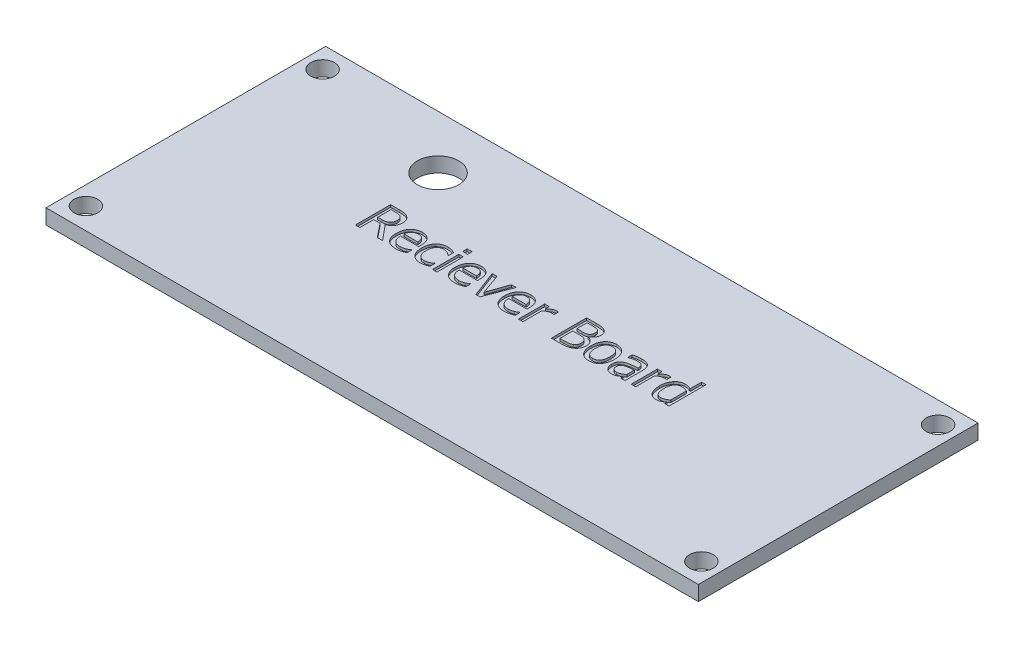
from build123d import *

# Parameters (mm, degrees)
SKETCH1_W           = 70
SKETCH1_H           = 30
SKETCH1_R           = 1.27
BOSS_EXTRUDE1_DEPTH = 1.6
SKETCH2_W           = 0.478039706
SKETCH2_H           = 2.820434261
SKETCH2_W_2         = 0.525843676
SKETCH2_H_2         = 0.478039705
CUT_EXTRUDE1_DEPTH  = 0.254
SKETCH3_R           = 2.2225
CUT_EXTRUDE2_DEPTH  = 39.112465284


with BuildPart() as part:
    # Sketch1 → Boss-Extrude1 (new body)
    with BuildSketch(Plane(origin=(0, 0, 0), x_dir=(1, 0, 0), z_dir=(0, 1, 0))):
        Rectangle(SKETCH1_W, SKETCH1_H)
        with Locations(Location((-33.02, 12.7, 0), (0, 0, 270))):
            Circle(SKETCH1_R, mode=Mode.SUBTRACT)
        with Locations(Location((-33.02, -12.7, 0), (0, 0, 270))):
            Circle(SKETCH1_R, mode=Mode.SUBTRACT)
        with Locations(Location((33.02, 12.7, 0), (0, 0, 270))):
            Circle(SKETCH1_R, mode=Mode.SUBTRACT)
        with Locations(Location((33.02, -12.7, 0), (0, 0, 270))):
            Circle(SKETCH1_R, mode=Mode.SUBTRACT)
    extrude(amount=BOSS_EXTRUDE1_DEPTH)

    # Sketch2 → Cut-Extrude1 (cut)
    # profile 1 of 14: a face of its own
    with BuildSketch(Plane(origin=(0, 1.6, 0), x_dir=(1, 0, 0), z_dir=(0, 1, 0))):
        with BuildLine():
            Line((-13.887053439, 0), (-14.450243967, 0))
            Line((-14.450243967, 0), (-15.640861608, 1.481923086))
            Line((-15.640861608, 1.481923086), (-16.325055936, 1.481923086))
            Line((-16.325055936, 1.481923086), (-16.325055936, 0))
            Line((-16.325055936, 0), (-16.803095641, 0))
            Line((-16.803095641, 0), (-16.803095641, 3.776513672))
            Line((-16.803095641, 3.776513672), (-15.838052986, 3.776513672))
            add(Edge.make_bspline(
                [(-15.838052986, 3.776513672), (-15.786506721, 3.776121723), (-15.687848091, 3.775371539), (-15.546320768, 3.768693237), (-15.417970741, 3.757661959), (-15.300472771, 3.742556709), (-15.190459468, 3.718933758), (-15.085591724, 3.682290452), (-14.982604574, 3.635527111), (-14.918380546, 3.594808339), (-14.885708261, 3.574093734)],
                knots=[0, 0, 0, 0, 1.250021561, 2.392518902, 3.435016966, 4.373492712, 5.264191783, 6.15783316, 7.062846051, 8, 8, 8, 8], degree=3))
            add(Edge.make_bspline(
                [(-14.885708261, 3.574093734), (-14.853997125, 3.551939597), (-14.791207784, 3.508073504), (-14.707715848, 3.429296036), (-14.635006774, 3.341329418), (-14.571949601, 3.244099511), (-14.521544073, 3.13573354), (-14.485554783, 3.015325393), (-14.46500475, 2.882885163), (-14.462171449, 2.790629582), (-14.460701085, 2.742752809)],
                knots=[0, 0, 0, 0, 0.949219863, 1.879494016, 2.808983798, 3.7471254, 4.718469304, 5.734235897, 6.824163568, 8, 8, 8, 8], degree=3))
            add(Edge.make_bspline(
                [(-14.460701085, 2.742752809), (-14.461192274, 2.708370793), (-14.462151829, 2.641204232), (-14.472085548, 2.542570573), (-14.488705457, 2.448314187), (-14.510520908, 2.35791213), (-14.54026143, 2.272228083), (-14.575050057, 2.19049346), (-14.617056234, 2.113204363), (-14.665849295, 2.040857408), (-14.719762676, 1.972890302), (-14.778150736, 1.908939039), (-14.841845455, 1.850042056), (-14.909962746, 1.795341833), (-14.982656711, 1.745260311), (-15.059606035, 1.699519572), (-15.141697279, 1.659001569), (-15.198773666, 1.63569563), (-15.227805425, 1.623841124)],
                knots=[0, 0, 0, 0, 1.135849185, 2.218924117, 3.271251503, 4.296900366, 5.288183372, 6.264778873, 7.229344086, 8.190006651, 9.144696713, 10.093840338, 11.04856585, 12.008382513, 12.978301311, 13.963179042, 14.963976192, 16, 16, 16, 16], degree=3))
            Line((-15.227805425, 1.623841124), (-13.887053439, 0))
        make_face()
        with BuildLine():
            add(Edge.make_bspline(
                [(-14.986544761, 2.710634516), (-14.987322612, 2.737550273), (-14.988841193, 2.790097343), (-14.998892205, 2.866664154), (-15.018040647, 2.938129), (-15.043397444, 3.005158417), (-15.075794881, 3.067605662), (-15.117955218, 3.123466649), (-15.167249773, 3.174343318), (-15.205926774, 3.202178083), (-15.225564614, 3.216310892)],
                knots=[0, 0, 0, 0, 1.106361022, 2.159925501, 3.165170322, 4.140113613, 5.101428227, 6.044931032, 7.007334338, 8, 8, 8, 8], degree=3))
            add(Edge.make_bspline(
                [(-15.225564614, 3.216310892), (-15.243763939, 3.227671825), (-15.280595723, 3.250664073), (-15.341108414, 3.278179507), (-15.405950741, 3.300442334), (-15.476032459, 3.317524252), (-15.552065248, 3.331290448), (-15.636246719, 3.339427992), (-15.728897447, 3.345992599), (-15.793720344, 3.346180003), (-15.827595868, 3.346277937)],
                knots=[0, 0, 0, 0, 0.823266866, 1.666126959, 2.546139776, 3.452968417, 4.434002246, 5.511135704, 6.699354941, 8, 8, 8, 8], degree=3))
            Line((-15.827595868, 3.346277937), (-16.325055936, 3.346277937))
            Line((-16.325055936, 3.346277937), (-16.325055936, 1.912158821))
            Line((-16.325055936, 1.912158821), (-15.882869209, 1.912158821))
            add(Edge.make_bspline(
                [(-15.882869209, 1.912158821), (-15.847748388, 1.912502483), (-15.779165095, 1.91317358), (-15.679199425, 1.920895333), (-15.584707508, 1.932841136), (-15.495552492, 1.948622546), (-15.411233816, 1.971665641), (-15.334420901, 2.007656644), (-15.262219712, 2.051503588), (-15.22100378, 2.089430743), (-15.200168754, 2.108603263)],
                knots=[0, 0, 0, 0, 1.15528095, 2.256011433, 3.296444933, 4.287767307, 5.234068766, 6.161497088, 7.070620185, 8, 8, 8, 8], degree=3))
            add(Edge.make_bspline(
                [(-15.200168754, 2.108603263), (-15.182450094, 2.126823432), (-15.147026428, 2.163249732), (-15.103750863, 2.225805217), (-15.066020672, 2.292215373), (-15.037530736, 2.364660734), (-15.013825676, 2.442213633), (-14.997867572, 2.52609797), (-14.987921848, 2.616277417), (-14.98701392, 2.678488063), (-14.986544761, 2.710634516)],
                knots=[0, 0, 0, 0, 0.926938848, 1.853163429, 2.769284665, 3.711756545, 4.690105091, 5.728268696, 6.826115637, 8, 8, 8, 8], degree=3))
        make_face(mode=Mode.SUBTRACT)
    # profile 2 of 14: a face of its own
    with BuildSketch(Plane(origin=(0, 1.6, 0), x_dir=(1, 0, 0), z_dir=(0, 1, 0))):
        with BuildLine():
            add(Edge.make_bspline(
                [(-12.416334408, -0.047803971), (-12.471168186, -0.046755421), (-12.577906876, -0.04471433), (-12.733206157, -0.026027222), (-12.879537078, 0.002096439), (-13.015925966, 0.04445528), (-13.143547109, 0.097262978), (-13.261016838, 0.163453389), (-13.369566982, 0.240681418), (-13.467791592, 0.330005432), (-13.555219378, 0.430454672), (-13.63213608, 0.540881747), (-13.696412929, 0.661880071), (-13.748579531, 0.792763555), (-13.789919711, 0.933241083), (-13.818564666, 1.08383659), (-13.835888965, 1.244488789), (-13.838107769, 1.354898813), (-13.839249468, 1.411711005)],
                knots=[0, 0, 0, 0, 1.134380914, 2.208170522, 3.232879553, 4.214092303, 5.158657297, 6.086073904, 6.998364966, 7.910321261, 8.826967652, 9.748928482, 10.689479218, 11.655913905, 12.660314108, 13.715357398, 14.82442239, 16, 16, 16, 16], degree=3))
            add(Edge.make_bspline(
                [(-13.839249468, 1.411711005), (-13.838017924, 1.467768182), (-13.835615056, 1.577141444), (-13.819367062, 1.736829692), (-13.79102053, 1.887483425), (-13.751401892, 2.029495086), (-13.700714722, 2.162932029), (-13.638525131, 2.287624672), (-13.564996317, 2.403328809), (-13.480560389, 2.509440443), (-13.386801667, 2.604696913), (-13.285509737, 2.68823589), (-13.177161104, 2.759113529), (-13.061876105, 2.816804248), (-12.939187793, 2.861101362), (-12.810097638, 2.893219966), (-12.673580659, 2.912009867), (-12.580469595, 2.91467789), (-12.532856586, 2.916042202)],
                knots=[0, 0, 0, 0, 1.199395152, 2.340142072, 3.429892914, 4.475587674, 5.490682445, 6.479391523, 7.451820572, 8.418585917, 9.375422142, 10.306492715, 11.222598817, 12.13983495, 13.058307876, 14.007969104, 14.981360766, 16, 16, 16, 16], degree=3))
            add(Edge.make_bspline(
                [(-12.532856586, 2.916042202), (-12.490239722, 2.915295533), (-12.407491955, 2.913845749), (-12.286986322, 2.899345008), (-12.174258451, 2.875602907), (-12.068292118, 2.842974498), (-11.969926407, 2.798934869), (-11.876910145, 2.746126801), (-11.791470564, 2.68050451), (-11.740103351, 2.630016225), (-11.714213591, 2.604569457)],
                knots=[0, 0, 0, 0, 1.1333801, 2.200646914, 3.223065537, 4.195129444, 5.144102495, 6.084833041, 7.034730342, 8, 8, 8, 8], degree=3))
            add(Edge.make_bspline(
                [(-11.714213591, 2.604569457), (-11.689527191, 2.577044919), (-11.639720288, 2.521511831), (-11.578680795, 2.425943808), (-11.524062621, 2.323121883), (-11.479204131, 2.210207722), (-11.44391419, 2.086133382), (-11.418932376, 1.94985217), (-11.40413594, 1.800444983), (-11.402235941, 1.696578257), (-11.401246971, 1.64251455)],
                knots=[0, 0, 0, 0, 0.854390883, 1.72380602, 2.615618053, 3.54654076, 4.529594302, 5.596469888, 6.748937673, 8, 8, 8, 8], degree=3))
            Line((-11.401246971, 1.64251455), (-11.401246971, 1.386315145))
            Line((-11.401246971, 1.386315145), (-13.361209763, 1.386315145))
            add(Edge.make_bspline(
                [(-13.361209763, 1.386315145), (-13.360606988, 1.346694102), (-13.359436383, 1.2697489), (-13.347139172, 1.158133668), (-13.327850054, 1.053718378), (-13.301385532, 0.956195768), (-13.26607069, 0.866176539), (-13.223353491, 0.783089023), (-13.172436638, 0.707391399), (-13.113814549, 0.639191627), (-13.048691854, 0.57820205), (-12.976675907, 0.525988363), (-12.898948031, 0.48165662), (-12.815845734, 0.444598503), (-12.725899313, 0.417236405), (-12.630384571, 0.397466795), (-12.529002274, 0.384005394), (-12.459453041, 0.38296503), (-12.423803779, 0.382431764)],
                knots=[0, 0, 0, 0, 1.216707001, 2.362879872, 3.444454967, 4.476175845, 5.461878662, 6.409455199, 7.340716607, 8.257416267, 9.166586768, 10.075306755, 10.983189478, 11.911210175, 12.864357389, 13.864904012, 14.905601209, 16, 16, 16, 16], degree=3))
            add(Edge.make_bspline(
                [(-12.423803779, 0.382431764), (-12.371909669, 0.384240778), (-12.26850302, 0.387845505), (-12.117058969, 0.414009433), (-11.974599688, 0.453340721), (-11.88548284, 0.489201902), (-11.842686762, 0.506423313)],
                knots=[0, 0, 0, 0, 1.040774474, 2.073896268, 3.075038149, 4, 4, 4, 4], degree=3))
            add(Edge.make_bspline(
                [(-11.842686762, 0.506423313), (-11.802599004, 0.524579945), (-11.728400468, 0.558186102), (-11.628417024, 0.612517761), (-11.546484799, 0.664868682), (-11.498668085, 0.70062365), (-11.476687612, 0.717059558)],
                knots=[0, 0, 0, 0, 1.24700779, 2.308089957, 3.222259739, 4, 4, 4, 4], degree=3))
            Line((-11.476687612, 0.717059558), (-11.449050942, 0.717059558))
            Line((-11.449050942, 0.717059558), (-11.449050942, 0.189722008))
            add(Edge.make_bspline(
                [(-11.449050942, 0.189722008), (-11.463745163, 0.184006812), (-11.494899947, 0.171889415), (-11.544186488, 0.152440751), (-11.598725081, 0.130804227), (-11.675498349, 0.099905635), (-11.768741393, 0.063578627), (-11.844030652, 0.04113445), (-11.879286677, 0.030624419)],
                knots=[0, 0, 0, 0, 0.618404991, 1.311146348, 2.078231156, 2.919664622, 4.557558146, 6, 6, 6, 6], degree=3))
            add(Edge.make_bspline(
                [(-11.879286677, 0.030624419), (-11.92351099, 0.019038894), (-12.007086171, -0.002855451), (-12.111388058, -0.024814447), (-12.193751208, -0.037668284), (-12.26138952, -0.043106179), (-12.336368788, -0.04689261), (-12.388940988, -0.04749177), (-12.416334408, -0.047803971)],
                knots=[0, 0, 0, 0, 1.510367165, 2.854294389, 3.519768625, 4.263063433, 5.094946904, 6, 6, 6, 6], degree=3))
        make_face()
        with BuildLine():
            add(Edge.make_bspline(
                [(-11.879286677, 1.76874691), (-11.880336043, 1.798906365), (-11.882370649, 1.857382244), (-11.892555594, 1.941350398), (-11.905500195, 2.019097278), (-11.923892839, 2.090297788), (-11.944690896, 2.15655642), (-11.972572393, 2.216425623), (-12.002130271, 2.272530037), (-12.027447343, 2.305360441), (-12.03987814, 2.321480319)],
                knots=[0, 0, 0, 0, 1.236164111, 2.396786802, 3.46369526, 4.463501213, 5.408927413, 6.304065453, 7.167288431, 8, 8, 8, 8], degree=3))
            add(Edge.make_bspline(
                [(-12.03987814, 2.321480319), (-12.054139172, 2.338085584), (-12.082690816, 2.371330556), (-12.133579985, 2.413867568), (-12.18977984, 2.450908489), (-12.252559782, 2.480600581), (-12.32148618, 2.505021221), (-12.397953983, 2.521936213), (-12.482329871, 2.531294225), (-12.541049264, 2.532816106), (-12.571697312, 2.533610438)],
                knots=[0, 0, 0, 0, 0.884081658, 1.769997038, 2.672248212, 3.600158832, 4.571643759, 5.624690267, 6.760228868, 8, 8, 8, 8], degree=3))
            add(Edge.make_bspline(
                [(-12.571697312, 2.533610438), (-12.601861505, 2.532915749), (-12.659892427, 2.531579283), (-12.743601518, 2.520760913), (-12.820760084, 2.50440223), (-12.891052233, 2.478972762), (-12.95642572, 2.44803507), (-13.017637114, 2.410254246), (-13.076625188, 2.367044508), (-13.112320741, 2.333332337), (-13.130406218, 2.31625176)],
                knots=[0, 0, 0, 0, 1.173564647, 2.257744428, 3.280459802, 4.236741982, 5.159998422, 6.090700802, 7.032636205, 8, 8, 8, 8], degree=3))
            add(Edge.make_bspline(
                [(-13.130406218, 2.31625176), (-13.147239912, 2.298160399), (-13.180711837, 2.262187742), (-13.223414092, 2.202816769), (-13.261732667, 2.141417694), (-13.29194559, 2.075617996), (-13.318145897, 2.006445296), (-13.336559683, 1.931785146), (-13.353320438, 1.85249124), (-13.358527954, 1.79721402), (-13.361209763, 1.76874691)],
                knots=[0, 0, 0, 0, 0.976167885, 1.941001143, 2.886504833, 3.833340147, 4.798926495, 5.806605134, 6.870427755, 8, 8, 8, 8], degree=3))
            Line((-13.361209763, 1.76874691), (-11.879286677, 1.76874691))
        make_face(mode=Mode.SUBTRACT)
    # profile 3 of 14: a face of its own
    with BuildSketch(Plane(origin=(0, 1.6, 0), x_dir=(1, 0, 0), z_dir=(0, 1, 0))):
        with BuildLine():
            add(Edge.make_bspline(
                [(-9.797573148, -0.047803971), (-9.844918508, -0.046537983), (-9.938152611, -0.044044958), (-10.075052275, -0.02790608), (-10.205811381, 0.001135287), (-10.330782598, 0.039260349), (-10.448561514, 0.089924543), (-10.557343068, 0.153497601), (-10.658871526, 0.22704958), (-10.718013109, 0.285759826), (-10.747677062, 0.315207431)],
                knots=[0, 0, 0, 0, 1.086346663, 2.139270977, 3.156682832, 4.155857093, 5.133237932, 6.09051243, 7.042248364, 8, 8, 8, 8], degree=3))
            add(Edge.make_bspline(
                [(-10.747677062, 0.315207431), (-10.775824404, 0.346969568), (-10.833035931, 0.41152843), (-10.906030637, 0.521576966), (-10.96875748, 0.643511948), (-11.021964353, 0.776948124), (-11.063815045, 0.922779388), (-11.093103788, 1.080848426), (-11.111284916, 1.250943667), (-11.113355306, 1.368340808), (-11.114423148, 1.428890557)],
                knots=[0, 0, 0, 0, 0.84705885, 1.721708906, 2.629397132, 3.582622272, 4.586996576, 5.655224541, 6.790638648, 8, 8, 8, 8], degree=3))
            add(Edge.make_bspline(
                [(-11.114423148, 1.428890557), (-11.113398721, 1.48894421), (-11.111412524, 1.605378527), (-11.092690436, 1.773602379), (-11.061569831, 1.929134851), (-11.018189258, 2.072228379), (-10.963275696, 2.203063465), (-10.900280333, 2.323223905), (-10.829974977, 2.433368031), (-10.7748053, 2.498564192), (-10.747677062, 2.53062269)],
                knots=[0, 0, 0, 0, 1.212928677, 2.351672441, 3.414125596, 4.413388184, 5.367178006, 6.276171073, 7.152352457, 8, 8, 8, 8], degree=3))
            add(Edge.make_bspline(
                [(-10.747677062, 2.53062269), (-10.719030506, 2.560552051), (-10.661384253, 2.620779729), (-10.561076986, 2.696930154), (-10.451646011, 2.763740474), (-10.332285964, 2.818200551), (-10.205813778, 2.862328012), (-10.073665081, 2.893564401), (-9.937078757, 2.912881597), (-9.844445432, 2.914980275), (-9.797573148, 2.916042202)],
                knots=[0, 0, 0, 0, 0.940777118, 1.893151754, 2.853419479, 3.851446973, 4.870214463, 5.894613796, 6.934678609, 8, 8, 8, 8], degree=3))
            add(Edge.make_bspline(
                [(-9.797573148, 2.916042202), (-9.758937755, 2.915493858), (-9.682445924, 2.914408224), (-9.568995409, 2.900556547), (-9.45739415, 2.881264767), (-9.349055056, 2.851363574), (-9.244680975, 2.817096698), (-9.145265524, 2.780498746), (-9.051446513, 2.742137415), (-8.992222663, 2.712960009), (-8.963244474, 2.698683524)],
                knots=[0, 0, 0, 0, 1.065178939, 2.108882096, 3.148962845, 4.186932259, 5.205633319, 6.179176006, 7.109072084, 8, 8, 8, 8], degree=3))
            Line((-8.963244474, 2.698683524), (-8.963244474, 2.151178674))
            Line((-8.963244474, 2.151178674), (-8.991628082, 2.151178674))
            add(Edge.make_bspline(
                [(-8.991628082, 2.151178674), (-9.010898809, 2.166566134), (-9.053494829, 2.200578581), (-9.127068663, 2.251640358), (-9.21546717, 2.308419523), (-9.282341867, 2.342745032), (-9.318039568, 2.361067982)],
                knots=[0, 0, 0, 0, 0.760821841, 1.681720812, 2.76250299, 4, 4, 4, 4], degree=3))
            add(Edge.make_bspline(
                [(-9.318039568, 2.361067982), (-9.353841664, 2.377537809), (-9.429821659, 2.412490437), (-9.553036019, 2.449990746), (-9.681868072, 2.480803433), (-9.769763014, 2.48416939), (-9.812511888, 2.485806468)],
                knots=[0, 0, 0, 0, 0.919201633, 1.950749942, 3.00331998, 4, 4, 4, 4], degree=3))
            add(Edge.make_bspline(
                [(-9.812511888, 2.485806468), (-9.842930658, 2.484926528), (-9.902299468, 2.483209136), (-9.989266493, 2.470308644), (-10.071351983, 2.448617717), (-10.149508092, 2.418913245), (-10.22175078, 2.37850085), (-10.290629349, 2.331678547), (-10.353659235, 2.274523415), (-10.412402275, 2.209902882), (-10.465818453, 2.137373122), (-10.511049254, 2.056792409), (-10.550473021, 1.969752476), (-10.581004402, 1.875046067), (-10.607237553, 1.773996418), (-10.623495368, 1.665096194), (-10.634258803, 1.549365503), (-10.635662867, 1.469749901), (-10.636383443, 1.428890557)],
                knots=[0, 0, 0, 0, 0.96605132, 1.885458188, 2.7851623, 3.659050416, 4.533260571, 5.408614793, 6.299234987, 7.228656297, 8.179369905, 9.153481195, 10.158875602, 11.209300669, 12.310342647, 13.471469653, 14.702338617, 16, 16, 16, 16], degree=3))
            add(Edge.make_bspline(
                [(-10.636383443, 1.428890557), (-10.635554694, 1.388790139), (-10.633941045, 1.31071104), (-10.624683412, 1.19706568), (-10.607223147, 1.090293783), (-10.583804184, 0.99024596), (-10.552786644, 0.896896693), (-10.516079995, 0.809840778), (-10.470536025, 0.730572683), (-10.420288535, 0.657427732), (-10.362321455, 0.593508417), (-10.300021175, 0.53650124), (-10.231755982, 0.488570149), (-10.158008935, 0.449367395), (-10.078823421, 0.419584573), (-9.994746501, 0.397764297), (-9.905269031, 0.385061104), (-9.843923542, 0.383322175), (-9.812511888, 0.382431764)],
                knots=[0, 0, 0, 0, 1.278182357, 2.488735323, 3.630218041, 4.723433377, 5.759789306, 6.762139839, 7.728671364, 8.668682231, 9.58467326, 10.472351731, 11.355157794, 12.235499659, 13.127106322, 14.045157303, 14.999032454, 16, 16, 16, 16], degree=3))
            add(Edge.make_bspline(
                [(-9.812511888, 0.382431764), (-9.773855579, 0.383616499), (-9.697156829, 0.385967156), (-9.58347972, 0.403755534), (-9.472657704, 0.432556688), (-9.365919381, 0.474445044), (-9.263494774, 0.524298483), (-9.165935944, 0.580866673), (-9.075267481, 0.645320048), (-9.019415736, 0.693225424), (-8.991628082, 0.717059558)],
                knots=[0, 0, 0, 0, 1.023081668, 2.029916626, 3.038799423, 4.048736851, 5.05994268, 6.052565239, 7.031102016, 8, 8, 8, 8], degree=3))
            Line((-8.991628082, 0.717059558), (-8.963244474, 0.717059558))
            Line((-8.963244474, 0.717059558), (-8.963244474, 0.17403633))
            add(Edge.make_bspline(
                [(-8.963244474, 0.17403633), (-8.989872043, 0.161803592), (-9.048708017, 0.134774271), (-9.140743094, 0.093379859), (-9.236352022, 0.053450928), (-9.301675912, 0.034336633), (-9.332231372, 0.025395859)],
                knots=[0, 0, 0, 0, 0.882835733, 1.950703813, 3.041435122, 4, 4, 4, 4], degree=3))
            add(Edge.make_bspline(
                [(-9.332231372, 0.025395859), (-9.37048994, 0.014638639), (-9.442648397, -0.005650265), (-9.53266061, -0.026701949), (-9.603912101, -0.038146713), (-9.662250274, -0.044137575), (-9.727589697, -0.046620076), (-9.773421468, -0.047395402), (-9.797573148, -0.047803971)],
                knots=[0, 0, 0, 0, 1.51193838, 2.85162635, 3.513436262, 4.256115545, 5.081036189, 6, 6, 6, 6], degree=3))
        make_face()
    # profile 4 of 14: a face of its own
    with BuildSketch(Plane(origin=(0, 1.6, 0), x_dir=(1, 0, 0), z_dir=(0, 1, 0))):
        with Locations((-8.293988887, 1.410217131)):
            Rectangle(SKETCH2_W, SKETCH2_H)
    # profile 5 of 14: a face of its own
    with BuildSketch(Plane(origin=(0, 1.6, 0), x_dir=(1, 0, 0), z_dir=(0, 1, 0))):
        with Locations((-8.317890872, 3.537493819)):
            Rectangle(SKETCH2_W_2, SKETCH2_H_2)
    # profile 6 of 14: a face of its own
    with BuildSketch(Plane(origin=(0, 1.6, 0), x_dir=(1, 0, 0), z_dir=(0, 1, 0))):
        with BuildLine():
            add(Edge.make_bspline(
                [(-6.106210298, -0.047803971), (-6.161044076, -0.046755421), (-6.267782766, -0.04471433), (-6.423082048, -0.026027222), (-6.569412968, 0.002096439), (-6.705801856, 0.04445528), (-6.833422999, 0.097262978), (-6.950892728, 0.163453389), (-7.059442872, 0.240681418), (-7.157667482, 0.330005432), (-7.245095268, 0.430454672), (-7.32201197, 0.540881747), (-7.386288819, 0.661880071), (-7.438455421, 0.792763555), (-7.479795601, 0.933241083), (-7.508440556, 1.08383659), (-7.525764855, 1.244488789), (-7.527983659, 1.354898813), (-7.529125358, 1.411711005)],
                knots=[0, 0, 0, 0, 1.134380914, 2.208170522, 3.232879553, 4.214092303, 5.158657297, 6.086073904, 6.998364966, 7.910321261, 8.826967652, 9.748928482, 10.689479218, 11.655913905, 12.660314108, 13.715357398, 14.82442239, 16, 16, 16, 16], degree=3))
            add(Edge.make_bspline(
                [(-7.529125358, 1.411711005), (-7.527893814, 1.467768182), (-7.525490946, 1.577141444), (-7.509242952, 1.736829692), (-7.48089642, 1.887483425), (-7.441277782, 2.029495086), (-7.390590612, 2.162932029), (-7.328401021, 2.287624672), (-7.254872207, 2.403328809), (-7.170436279, 2.509440443), (-7.076677557, 2.604696913), (-6.975385627, 2.68823589), (-6.867036994, 2.759113529), (-6.751751995, 2.816804248), (-6.629063683, 2.861101362), (-6.499973528, 2.893219966), (-6.363456549, 2.912009867), (-6.270345485, 2.91467789), (-6.222732476, 2.916042202)],
                knots=[0, 0, 0, 0, 1.199395152, 2.340142072, 3.429892914, 4.475587674, 5.490682445, 6.479391523, 7.451820572, 8.418585917, 9.375422142, 10.306492715, 11.222598817, 12.13983495, 13.058307876, 14.007969104, 14.981360766, 16, 16, 16, 16], degree=3))
            add(Edge.make_bspline(
                [(-6.222732476, 2.916042202), (-6.180115612, 2.915295533), (-6.097367845, 2.913845749), (-5.976862212, 2.899345008), (-5.864134341, 2.875602907), (-5.758168008, 2.842974498), (-5.659802298, 2.798934869), (-5.566786035, 2.746126801), (-5.481346454, 2.68050451), (-5.429979241, 2.630016225), (-5.404089481, 2.604569457)],
                knots=[0, 0, 0, 0, 1.1333801, 2.200646914, 3.223065537, 4.195129444, 5.144102495, 6.084833041, 7.034730342, 8, 8, 8, 8], degree=3))
            add(Edge.make_bspline(
                [(-5.404089481, 2.604569457), (-5.379403082, 2.577044919), (-5.329596178, 2.521511831), (-5.268556685, 2.425943808), (-5.213938511, 2.323121883), (-5.169080021, 2.210207722), (-5.13379008, 2.086133382), (-5.108808266, 1.94985217), (-5.09401183, 1.800444983), (-5.092111831, 1.696578257), (-5.091122861, 1.64251455)],
                knots=[0, 0, 0, 0, 0.854390883, 1.72380602, 2.615618053, 3.54654076, 4.529594302, 5.596469888, 6.748937673, 8, 8, 8, 8], degree=3))
            Line((-5.091122861, 1.64251455), (-5.091122861, 1.386315145))
            Line((-5.091122861, 1.386315145), (-7.051085653, 1.386315145))
            add(Edge.make_bspline(
                [(-7.051085653, 1.386315145), (-7.050482878, 1.346694102), (-7.049312273, 1.2697489), (-7.037015062, 1.158133668), (-7.017725944, 1.053718378), (-6.991261422, 0.956195768), (-6.95594658, 0.866176539), (-6.913229381, 0.783089023), (-6.862312528, 0.707391399), (-6.803690439, 0.639191627), (-6.738567744, 0.57820205), (-6.666551797, 0.525988363), (-6.588823921, 0.48165662), (-6.505721624, 0.444598503), (-6.415775204, 0.417236405), (-6.320260461, 0.397466795), (-6.218878164, 0.384005394), (-6.149328931, 0.38296503), (-6.113679669, 0.382431764)],
                knots=[0, 0, 0, 0, 1.216707001, 2.362879872, 3.444454967, 4.476175845, 5.461878662, 6.409455199, 7.340716607, 8.257416267, 9.166586768, 10.075306755, 10.983189478, 11.911210175, 12.864357389, 13.864904012, 14.905601209, 16, 16, 16, 16], degree=3))
            add(Edge.make_bspline(
                [(-6.113679669, 0.382431764), (-6.061785559, 0.384240778), (-5.95837891, 0.387845505), (-5.806934859, 0.414009433), (-5.664475578, 0.453340721), (-5.57535873, 0.489201902), (-5.532562652, 0.506423313)],
                knots=[0, 0, 0, 0, 1.040774474, 2.073896268, 3.075038149, 4, 4, 4, 4], degree=3))
            add(Edge.make_bspline(
                [(-5.532562652, 0.506423313), (-5.492474894, 0.524579945), (-5.418276358, 0.558186102), (-5.318292915, 0.612517761), (-5.236360689, 0.664868682), (-5.188543975, 0.70062365), (-5.166563502, 0.717059558)],
                knots=[0, 0, 0, 0, 1.24700779, 2.308089957, 3.222259739, 4, 4, 4, 4], degree=3))
            Line((-5.166563502, 0.717059558), (-5.138926832, 0.717059558))
            Line((-5.138926832, 0.717059558), (-5.138926832, 0.189722008))
            add(Edge.make_bspline(
                [(-5.138926832, 0.189722008), (-5.153621053, 0.184006812), (-5.184775837, 0.171889415), (-5.234062378, 0.152440751), (-5.288600971, 0.130804227), (-5.365374239, 0.099905635), (-5.458617283, 0.063578627), (-5.533906542, 0.04113445), (-5.569162567, 0.030624419)],
                knots=[0, 0, 0, 0, 0.618404991, 1.311146348, 2.078231156, 2.919664622, 4.557558146, 6, 6, 6, 6], degree=3))
            add(Edge.make_bspline(
                [(-5.569162567, 0.030624419), (-5.61338688, 0.019038894), (-5.696962061, -0.002855451), (-5.801263948, -0.024814447), (-5.883627098, -0.037668284), (-5.95126541, -0.043106179), (-6.026244678, -0.04689261), (-6.078816878, -0.04749177), (-6.106210298, -0.047803971)],
                knots=[0, 0, 0, 0, 1.510367165, 2.854294389, 3.519768625, 4.263063433, 5.094946904, 6, 6, 6, 6], degree=3))
        make_face()
        with BuildLine():
            add(Edge.make_bspline(
                [(-5.569162567, 1.76874691), (-5.570211933, 1.798906365), (-5.572246539, 1.857382244), (-5.582431484, 1.941350398), (-5.595376085, 2.019097278), (-5.61376873, 2.090297788), (-5.634566786, 2.15655642), (-5.662448283, 2.216425623), (-5.692006161, 2.272530037), (-5.717323233, 2.305360441), (-5.72975403, 2.321480319)],
                knots=[0, 0, 0, 0, 1.236164111, 2.396786802, 3.46369526, 4.463501213, 5.408927413, 6.304065453, 7.167288431, 8, 8, 8, 8], degree=3))
            add(Edge.make_bspline(
                [(-5.72975403, 2.321480319), (-5.744015062, 2.338085584), (-5.772566706, 2.371330556), (-5.823455875, 2.413867568), (-5.87965573, 2.450908489), (-5.942435672, 2.480600581), (-6.01136207, 2.505021221), (-6.087829873, 2.521936213), (-6.172205761, 2.531294225), (-6.230925154, 2.532816106), (-6.261573202, 2.533610438)],
                knots=[0, 0, 0, 0, 0.884081658, 1.769997038, 2.672248212, 3.600158832, 4.571643759, 5.624690267, 6.760228868, 8, 8, 8, 8], degree=3))
            add(Edge.make_bspline(
                [(-6.261573202, 2.533610438), (-6.291737395, 2.532915749), (-6.349768317, 2.531579283), (-6.433477408, 2.520760913), (-6.510635974, 2.50440223), (-6.580928123, 2.478972762), (-6.64630161, 2.44803507), (-6.707513004, 2.410254246), (-6.766501078, 2.367044508), (-6.802196632, 2.333332337), (-6.820282108, 2.31625176)],
                knots=[0, 0, 0, 0, 1.173564647, 2.257744428, 3.280459802, 4.236741982, 5.159998422, 6.090700802, 7.032636205, 8, 8, 8, 8], degree=3))
            add(Edge.make_bspline(
                [(-6.820282108, 2.31625176), (-6.837115802, 2.298160399), (-6.870587727, 2.262187742), (-6.913289982, 2.202816769), (-6.951608557, 2.141417694), (-6.98182148, 2.075617996), (-7.008021787, 2.006445296), (-7.026435573, 1.931785146), (-7.043196328, 1.85249124), (-7.048403844, 1.79721402), (-7.051085653, 1.76874691)],
                knots=[0, 0, 0, 0, 0.976167885, 1.941001143, 2.886504833, 3.833340147, 4.798926495, 5.806605134, 6.870427755, 8, 8, 8, 8], degree=3))
            Line((-7.051085653, 1.76874691), (-5.569162567, 1.76874691))
        make_face(mode=Mode.SUBTRACT)
    # profile 7 of 14: a face of its own
    with BuildSketch(Plane(origin=(0, 1.6, 0), x_dir=(1, 0, 0), z_dir=(0, 1, 0))):
        Polygon((-2.366296541, 2.820434261), (-3.444126689, 0), (-3.877350172, 0), (-4.94771095, 2.820434261), (-4.436806015, 2.820434261), (-3.65326906, 0.64834135), (-2.877948413, 2.820434261), align=None)
    # profile 8 of 14: a face of its own
    with BuildSketch(Plane(origin=(0, 1.6, 0), x_dir=(1, 0, 0), z_dir=(0, 1, 0))):
        with BuildLine():
            add(Edge.make_bspline(
                [(-0.799969569, -0.047803971), (-0.854803348, -0.046755421), (-0.961542038, -0.04471433), (-1.116841319, -0.026027222), (-1.263172239, 0.002096439), (-1.399561128, 0.04445528), (-1.527182271, 0.097262978), (-1.644651999, 0.163453389), (-1.753202143, 0.240681418), (-1.851426754, 0.330005432), (-1.938854539, 0.430454672), (-2.015771241, 0.540881747), (-2.08004809, 0.661880071), (-2.132214692, 0.792763555), (-2.173554872, 0.933241083), (-2.202199827, 1.08383659), (-2.219524126, 1.244488789), (-2.22174293, 1.354898813), (-2.22288463, 1.411711005)],
                knots=[0, 0, 0, 0, 1.134380914, 2.208170522, 3.232879553, 4.214092303, 5.158657297, 6.086073904, 6.998364966, 7.910321261, 8.826967652, 9.748928482, 10.689479218, 11.655913905, 12.660314108, 13.715357398, 14.82442239, 16, 16, 16, 16], degree=3))
            add(Edge.make_bspline(
                [(-2.22288463, 1.411711005), (-2.221653085, 1.467768182), (-2.219250217, 1.577141444), (-2.203002224, 1.736829692), (-2.174655692, 1.887483425), (-2.135037054, 2.029495086), (-2.084349883, 2.162932029), (-2.022160292, 2.287624672), (-1.948631478, 2.403328809), (-1.86419555, 2.509440443), (-1.770436828, 2.604696913), (-1.669144898, 2.68823589), (-1.560796265, 2.759113529), (-1.445511266, 2.816804248), (-1.322822954, 2.861101362), (-1.193732799, 2.893219966), (-1.05721582, 2.912009867), (-0.964104756, 2.91467789), (-0.916491748, 2.916042202)],
                knots=[0, 0, 0, 0, 1.199395152, 2.340142072, 3.429892914, 4.475587674, 5.490682445, 6.479391523, 7.451820572, 8.418585917, 9.375422142, 10.306492715, 11.222598817, 12.13983495, 13.058307876, 14.007969104, 14.981360766, 16, 16, 16, 16], degree=3))
            add(Edge.make_bspline(
                [(-0.916491748, 2.916042202), (-0.873874883, 2.915295533), (-0.791127117, 2.913845749), (-0.670621483, 2.899345008), (-0.557893612, 2.875602907), (-0.45192728, 2.842974498), (-0.353561569, 2.798934869), (-0.260545307, 2.746126801), (-0.175105725, 2.68050451), (-0.123738512, 2.630016225), (-0.097848752, 2.604569457)],
                knots=[0, 0, 0, 0, 1.1333801, 2.200646914, 3.223065537, 4.195129444, 5.144102495, 6.084833041, 7.034730342, 8, 8, 8, 8], degree=3))
            add(Edge.make_bspline(
                [(-0.097848752, 2.604569457), (-0.073162353, 2.577044919), (-0.023355449, 2.521511831), (0.037684044, 2.425943808), (0.092302218, 2.323121883), (0.137160708, 2.210207722), (0.172450648, 2.086133382), (0.197432463, 1.94985217), (0.212228899, 1.800444983), (0.214128898, 1.696578257), (0.215117867, 1.64251455)],
                knots=[0, 0, 0, 0, 0.854390883, 1.72380602, 2.615618053, 3.54654076, 4.529594302, 5.596469888, 6.748937673, 8, 8, 8, 8], degree=3))
            Line((0.215117867, 1.64251455), (0.215117867, 1.386315145))
            Line((0.215117867, 1.386315145), (-1.744844924, 1.386315145))
            add(Edge.make_bspline(
                [(-1.744844924, 1.386315145), (-1.74424215, 1.346694102), (-1.743071544, 1.2697489), (-1.730774333, 1.158133668), (-1.711485215, 1.053718378), (-1.685020693, 0.956195768), (-1.649705851, 0.866176539), (-1.606988652, 0.783089023), (-1.5560718, 0.707391399), (-1.49744971, 0.639191627), (-1.432327016, 0.57820205), (-1.360311068, 0.525988363), (-1.282583192, 0.48165662), (-1.199480896, 0.444598503), (-1.109534475, 0.417236405), (-1.014019732, 0.397466795), (-0.912637435, 0.384005394), (-0.843088202, 0.38296503), (-0.80743894, 0.382431764)],
                knots=[0, 0, 0, 0, 1.216707001, 2.362879872, 3.444454967, 4.476175845, 5.461878662, 6.409455199, 7.340716607, 8.257416267, 9.166586768, 10.075306755, 10.983189478, 11.911210175, 12.864357389, 13.864904012, 14.905601209, 16, 16, 16, 16], degree=3))
            add(Edge.make_bspline(
                [(-0.80743894, 0.382431764), (-0.75554483, 0.384240778), (-0.652138182, 0.387845505), (-0.50069413, 0.414009433), (-0.358234849, 0.453340721), (-0.269118001, 0.489201902), (-0.226321923, 0.506423313)],
                knots=[0, 0, 0, 0, 1.040774474, 2.073896268, 3.075038149, 4, 4, 4, 4], degree=3))
            add(Edge.make_bspline(
                [(-0.226321923, 0.506423313), (-0.186234165, 0.524579945), (-0.112035629, 0.558186102), (-0.012052186, 0.612517761), (0.06988004, 0.664868682), (0.117696753, 0.70062365), (0.139677226, 0.717059558)],
                knots=[0, 0, 0, 0, 1.24700779, 2.308089957, 3.222259739, 4, 4, 4, 4], degree=3))
            Line((0.139677226, 0.717059558), (0.167313897, 0.717059558))
            Line((0.167313897, 0.717059558), (0.167313897, 0.189722008))
            add(Edge.make_bspline(
                [(0.167313897, 0.189722008), (0.152619676, 0.184006812), (0.121464892, 0.171889415), (0.072178351, 0.152440751), (0.017639757, 0.130804227), (-0.05913351, 0.099905635), (-0.152376554, 0.063578627), (-0.227665814, 0.04113445), (-0.262921838, 0.030624419)],
                knots=[0, 0, 0, 0, 0.618404991, 1.311146348, 2.078231156, 2.919664622, 4.557558146, 6, 6, 6, 6], degree=3))
            add(Edge.make_bspline(
                [(-0.262921838, 0.030624419), (-0.307146151, 0.019038894), (-0.390721332, -0.002855451), (-0.495023219, -0.024814447), (-0.577386369, -0.037668284), (-0.645024681, -0.043106179), (-0.720003949, -0.04689261), (-0.77257615, -0.04749177), (-0.799969569, -0.047803971)],
                knots=[0, 0, 0, 0, 1.510367165, 2.854294389, 3.519768625, 4.263063433, 5.094946904, 6, 6, 6, 6], degree=3))
        make_face()
        with BuildLine():
            add(Edge.make_bspline(
                [(-0.262921838, 1.76874691), (-0.263971204, 1.798906365), (-0.26600581, 1.857382244), (-0.276190755, 1.941350398), (-0.289135357, 2.019097278), (-0.307528001, 2.090297788), (-0.328326057, 2.15655642), (-0.356207554, 2.216425623), (-0.385765432, 2.272530037), (-0.411082504, 2.305360441), (-0.423513301, 2.321480319)],
                knots=[0, 0, 0, 0, 1.236164111, 2.396786802, 3.46369526, 4.463501213, 5.408927413, 6.304065453, 7.167288431, 8, 8, 8, 8], degree=3))
            add(Edge.make_bspline(
                [(-0.423513301, 2.321480319), (-0.437774333, 2.338085584), (-0.466325977, 2.371330556), (-0.517215146, 2.413867568), (-0.573415002, 2.450908489), (-0.636194943, 2.480600581), (-0.705121341, 2.505021221), (-0.781589145, 2.521936213), (-0.865965032, 2.531294225), (-0.924684425, 2.532816106), (-0.955332474, 2.533610438)],
                knots=[0, 0, 0, 0, 0.884081658, 1.769997038, 2.672248212, 3.600158832, 4.571643759, 5.624690267, 6.760228868, 8, 8, 8, 8], degree=3))
            add(Edge.make_bspline(
                [(-0.955332474, 2.533610438), (-0.985496666, 2.532915749), (-1.043527589, 2.531579283), (-1.127236679, 2.520760913), (-1.204395245, 2.50440223), (-1.274687394, 2.478972762), (-1.340060881, 2.44803507), (-1.401272276, 2.410254246), (-1.46026035, 2.367044508), (-1.495955903, 2.333332337), (-1.514041379, 2.31625176)],
                knots=[0, 0, 0, 0, 1.173564647, 2.257744428, 3.280459802, 4.236741982, 5.159998422, 6.090700802, 7.032636205, 8, 8, 8, 8], degree=3))
            add(Edge.make_bspline(
                [(-1.514041379, 2.31625176), (-1.530875073, 2.298160399), (-1.564346998, 2.262187742), (-1.607049253, 2.202816769), (-1.645367829, 2.141417694), (-1.675580751, 2.075617996), (-1.701781058, 2.006445296), (-1.720194844, 1.931785146), (-1.736955599, 1.85249124), (-1.742163115, 1.79721402), (-1.744844924, 1.76874691)],
                knots=[0, 0, 0, 0, 0.976167885, 1.941001143, 2.886504833, 3.833340147, 4.798926495, 5.806605134, 6.870427755, 8, 8, 8, 8], degree=3))
            Line((-1.744844924, 1.76874691), (-0.262921838, 1.76874691))
        make_face(mode=Mode.SUBTRACT)
    # profile 9 of 14: a face of its own
    with BuildSketch(Plane(origin=(0, 1.6, 0), x_dir=(1, 0, 0), z_dir=(0, 1, 0))):
        with BuildLine():
            Line((2.175080659, 2.342394556), (2.150431737, 2.342394556))
            add(Edge.make_bspline(
                [(2.150431737, 2.342394556), (2.132505248, 2.342394556), (2.095656354, 2.342394556), (2.037395265, 2.342394556), (1.971664805, 2.342394556), (1.924856751, 2.342394556), (1.899460892, 2.342394556)],
                knots=[0, 0, 0, 0, 0.857142857, 1.761904762, 2.785714286, 4, 4, 4, 4], degree=3))
            add(Edge.make_bspline(
                [(1.899460892, 2.342394556), (1.868025034, 2.341379867), (1.804768768, 2.339338077), (1.710123627, 2.322844489), (1.615752744, 2.296707246), (1.522164877, 2.259862971), (1.430367549, 2.212782058), (1.34088217, 2.155165788), (1.25308784, 2.088311917), (1.198852067, 2.036451281), (1.171197278, 2.010007573)],
                knots=[0, 0, 0, 0, 0.918158094, 1.847547897, 2.799003439, 3.775852425, 4.781328384, 5.808652897, 6.882633396, 8, 8, 8, 8], degree=3))
            Line((1.171197278, 2.010007573), (1.171197278, 0))
            Line((1.171197278, 0), (0.693157573, 0))
            Line((0.693157573, 0), (0.693157573, 2.820434261))
            Line((0.693157573, 2.820434261), (1.171197278, 2.820434261))
            Line((1.171197278, 2.820434261), (1.171197278, 2.401402582))
            add(Edge.make_bspline(
                [(1.171197278, 2.401402582), (1.212132569, 2.437481275), (1.289691507, 2.505838555), (1.40556227, 2.595409406), (1.5123678, 2.669280499), (1.613432855, 2.72544414), (1.709217742, 2.768524085), (1.803051611, 2.797724751), (1.894951056, 2.816822156), (1.956140425, 2.819246857), (1.986105588, 2.820434261)],
                knots=[0, 0, 0, 0, 1.397222352, 2.647277652, 3.749204196, 4.719800068, 5.604929525, 6.433877147, 7.233050985, 8, 8, 8, 8], degree=3))
            add(Edge.make_bspline(
                [(1.986105588, 2.820434261), (2.007275497, 2.820461237), (2.043421005, 2.820507295), (2.092275934, 2.81730236), (2.134056964, 2.812150033), (2.160896226, 2.808285072), (2.175080659, 2.806242458)],
                knots=[0, 0, 0, 0, 1.338414679, 2.285209608, 3.093740796, 4, 4, 4, 4], degree=3))
            Line((2.175080659, 2.806242458), (2.175080659, 2.342394556))
        make_face()
    # profile 10 of 14: a face of its own
    with BuildSketch(Plane(origin=(0, 1.6, 0), x_dir=(1, 0, 0), z_dir=(0, 1, 0))):
        with BuildLine():
            add(Edge.make_bspline(
                [(6.812065801, 1.159993222), (6.810850259, 1.114350228), (6.808479646, 1.025334886), (6.787828082, 0.89601212), (6.754486968, 0.774749876), (6.707034252, 0.662433534), (6.648621822, 0.5592511), (6.580851745, 0.465022859), (6.504074915, 0.37972734), (6.445452341, 0.331209981), (6.41618917, 0.306991123)],
                knots=[0, 0, 0, 0, 1.123165247, 2.190455262, 3.215228591, 4.212553701, 5.184286694, 6.128502132, 7.065787126, 8, 8, 8, 8], degree=3))
            add(Edge.make_bspline(
                [(6.41618917, 0.306991123), (6.380089224, 0.280345753), (6.309052008, 0.227913185), (6.194748749, 0.1629086), (6.077592953, 0.108533121), (5.953605527, 0.066693551), (5.818993907, 0.035848451), (5.669075043, 0.014849552), (5.501400962, 0.002453602), (5.383695795, 0.000844451), (5.321926407, 0)],
                knots=[0, 0, 0, 0, 0.927198664, 1.82453489, 2.713902418, 3.594822979, 4.525332772, 5.565925983, 6.722645181, 8, 8, 8, 8], degree=3))
            Line((5.321926407, 0), (4.230651392, 0))
            Line((4.230651392, 0), (4.230651392, 3.776513672))
            Line((4.230651392, 3.776513672), (5.23528171, 3.776513672))
            add(Edge.make_bspline(
                [(5.23528171, 3.776513672), (5.267897368, 3.776229565), (5.331137009, 3.775678701), (5.422778422, 3.775454573), (5.507927402, 3.772945087), (5.586616621, 3.770090689), (5.659065958, 3.76624518), (5.725375445, 3.762282674), (5.785286614, 3.755710272), (5.856898118, 3.748582325), (5.941501763, 3.732807699), (6.040295224, 3.707289518), (6.136721762, 3.6710097), (6.19833182, 3.640365668), (6.22945491, 3.624885453)],
                knots=[0, 0, 0, 0, 1.154854136, 2.239187072, 3.244493279, 4.170784163, 5.027015506, 5.813369079, 6.522120364, 7.16073681, 8.360800599, 9.56464667, 10.769750865, 12, 12, 12, 12], degree=3))
            add(Edge.make_bspline(
                [(6.22945491, 3.624885453), (6.261606853, 3.606026344), (6.324009032, 3.569423596), (6.406685111, 3.502339669), (6.474711215, 3.425968923), (6.529266905, 3.341187989), (6.570075618, 3.248150684), (6.600510682, 3.147976094), (6.617378795, 3.039607104), (6.619671525, 2.964897667), (6.620849918, 2.926499321)],
                knots=[0, 0, 0, 0, 1.056660434, 2.050822028, 3.006562251, 3.94722149, 4.899115555, 5.880315037, 6.910547302, 8, 8, 8, 8], degree=3))
            add(Edge.make_bspline(
                [(6.620849918, 2.926499321), (6.619224, 2.883272995), (6.61603299, 2.79843746), (6.58786246, 2.674802884), (6.543103185, 2.557990214), (6.47960607, 2.449370614), (6.400817786, 2.349879313), (6.30817921, 2.260483778), (6.201995261, 2.181442496), (6.122784793, 2.140157155), (6.082308313, 2.119060381)],
                knots=[0, 0, 0, 0, 1.01042366, 1.983046925, 2.951472552, 3.927858262, 4.915187455, 5.912370339, 6.933223075, 8, 8, 8, 8], degree=3))
            Line((6.082308313, 2.119060381), (6.082308313, 2.098893081))
            add(Edge.make_bspline(
                [(6.082308313, 2.098893081), (6.110567269, 2.090813878), (6.16618188, 2.074913725), (6.246026726, 2.044865048), (6.321249997, 2.010765466), (6.390882833, 1.970715331), (6.456055844, 1.92684543), (6.516330597, 1.877884056), (6.571563033, 1.824132782), (6.621839714, 1.765655348), (6.666395622, 1.703051757), (6.705869248, 1.636814747), (6.738383452, 1.566576826), (6.765691027, 1.492722324), (6.786418217, 1.414919231), (6.801261459, 1.33324401), (6.81043265, 1.247843316), (6.811514569, 1.189644938), (6.812065801, 1.159993222)],
                knots=[0, 0, 0, 0, 1.091700035, 2.148503765, 3.1668263, 4.157111141, 5.129604985, 6.083213657, 7.038391686, 7.989663959, 8.944662764, 9.890295077, 10.850477816, 11.81634847, 12.812750759, 13.837983785, 14.898466038, 16, 16, 16, 16], degree=3))
        make_face()
        with BuildLine():
            add(Edge.make_bspline(
                [(6.095006243, 2.854793365), (6.094488361, 2.876740547), (6.093483271, 2.919335019), (6.084177129, 2.980597688), (6.070313007, 3.037722284), (6.049389303, 3.08999712), (6.02214803, 3.137865801), (5.988505298, 3.181033326), (5.946722734, 3.218081704), (5.91481999, 3.237689684), (5.898561801, 3.247682248)],
                knots=[0, 0, 0, 0, 1.138271041, 2.209124317, 3.208855371, 4.18304132, 5.120633581, 6.059026861, 7.010846631, 8, 8, 8, 8], degree=3))
            add(Edge.make_bspline(
                [(5.898561801, 3.247682248), (5.877629476, 3.258426898), (5.835301065, 3.280154247), (5.766952189, 3.303076731), (5.695734567, 3.321910127), (5.618660845, 3.331535799), (5.53314045, 3.337924098), (5.435019207, 3.343259286), (5.322441366, 3.346055335), (5.242503647, 3.346200873), (5.200175669, 3.346277937)],
                knots=[0, 0, 0, 0, 0.791046301, 1.599618392, 2.420950485, 3.267350129, 4.209188222, 5.308829398, 6.574993014, 8, 8, 8, 8], degree=3))
            Line((5.200175669, 3.346277937), (4.708691097, 3.346277937))
            Line((4.708691097, 3.346277937), (4.708691097, 2.246786615))
            Line((4.708691097, 2.246786615), (5.290555051, 2.246786615))
            add(Edge.make_bspline(
                [(5.290555051, 2.246786615), (5.327906187, 2.247038851), (5.397659886, 2.247509904), (5.494109112, 2.251718812), (5.574914907, 2.258898285), (5.642729998, 2.26918793), (5.703507035, 2.285024588), (5.762356266, 2.306632614), (5.821757353, 2.335565091), (5.860616306, 2.358312447), (5.880635312, 2.370031226)],
                knots=[0, 0, 0, 0, 1.463078288, 2.73231647, 3.780433788, 4.639859685, 5.415758795, 6.23651782, 7.091505077, 8, 8, 8, 8], degree=3))
            add(Edge.make_bspline(
                [(5.880635312, 2.370031226), (5.898956896, 2.382719419), (5.934812977, 2.407550725), (5.981131116, 2.452904982), (6.018094751, 2.50477616), (6.04755526, 2.562156234), (6.069045606, 2.62621403), (6.084588973, 2.696298725), (6.093450561, 2.773399913), (6.094472819, 2.826884591), (6.095006243, 2.854793365)],
                knots=[0, 0, 0, 0, 0.961120455, 1.880951613, 2.781995777, 3.700317984, 4.65564923, 5.691093411, 6.795192303, 8, 8, 8, 8], degree=3))
        make_face(mode=Mode.SUBTRACT)
        with BuildLine():
            add(Edge.make_bspline(
                [(6.286222125, 1.136091237), (6.285650771, 1.169747126), (6.284554824, 1.23430443), (6.272271327, 1.326568961), (6.253536781, 1.410012947), (6.225574156, 1.485353197), (6.186260952, 1.554670911), (6.128593174, 1.615280892), (6.057143367, 1.672300742), (6.000737502, 1.702199945), (5.971014694, 1.717955191)],
                knots=[0, 0, 0, 0, 1.141780988, 2.190116078, 3.153663142, 4.039011247, 4.910207185, 5.837486353, 6.860473518, 8, 8, 8, 8], degree=3))
            add(Edge.make_bspline(
                [(5.971014694, 1.717955191), (5.950278738, 1.728078822), (5.908863719, 1.74829831), (5.843216836, 1.771319498), (5.774989805, 1.788750034), (5.701599713, 1.799500528), (5.619628245, 1.808067095), (5.524625867, 1.812386491), (5.414585018, 1.816698141), (5.336124436, 1.816602093), (5.294289736, 1.81655088)],
                knots=[0, 0, 0, 0, 0.801096512, 1.599995097, 2.411899862, 3.243832192, 4.174262429, 5.27448247, 6.546770815, 8, 8, 8, 8], degree=3))
            Line((5.294289736, 1.81655088), (4.708691097, 1.81655088))
            Line((4.708691097, 1.81655088), (4.708691097, 0.430235735))
            Line((4.708691097, 0.430235735), (5.127722776, 0.430235735))
            add(Edge.make_bspline(
                [(5.127722776, 0.430235735), (5.181254402, 0.430780545), (5.282120533, 0.431807096), (5.424671647, 0.436300994), (5.548945968, 0.446305127), (5.65793794, 0.458124307), (5.755243896, 0.477436618), (5.84460898, 0.506401977), (5.928830812, 0.542166992), (5.980075116, 0.573744097), (6.005373798, 0.589333324)],
                knots=[0, 0, 0, 0, 1.419661482, 2.67497501, 3.780917185, 4.725157577, 5.581058162, 6.405834041, 7.212979904, 8, 8, 8, 8], degree=3))
            add(Edge.make_bspline(
                [(6.005373798, 0.589333324), (6.028385533, 0.605802443), (6.072900008, 0.637660716), (6.131901348, 0.691575117), (6.179912854, 0.749841783), (6.22025694, 0.811435702), (6.250632599, 0.880219471), (6.271096966, 0.957580737), (6.283790656, 1.043800867), (6.28538781, 1.10442348), (6.286222125, 1.136091237)],
                knots=[0, 0, 0, 0, 1.052116378, 2.035240147, 2.962554469, 3.854026021, 4.766185223, 5.745812808, 6.822468235, 8, 8, 8, 8], degree=3))
        make_face(mode=Mode.SUBTRACT)
    # profile 11 of 14: a face of its own
    with BuildSketch(Plane(origin=(0, 1.6, 0), x_dir=(1, 0, 0), z_dir=(0, 1, 0))):
        with BuildLine():
            add(Edge.make_bspline(
                [(9.584696091, 1.408723257), (9.583811665, 1.350420418), (9.582088194, 1.236806371), (9.565312476, 1.071804963), (9.538659777, 0.916953537), (9.501524553, 0.77210325), (9.45339044, 0.637231481), (9.392989711, 0.513098446), (9.322839343, 0.39889804), (9.241931688, 0.295614954), (9.152142337, 0.203605834), (9.054783977, 0.122939915), (8.94939505, 0.055618088), (8.837624875, -0.000186175), (8.718228807, -0.043019536), (8.591725584, -0.073171803), (8.458165802, -0.092576489), (8.366759543, -0.094583918), (8.320131683, -0.095607941)],
                knots=[0, 0, 0, 0, 1.258970204, 2.453340263, 3.577958263, 4.650140145, 5.679326874, 6.665462179, 7.626571561, 8.568962554, 9.49308545, 10.398555798, 11.29360157, 12.188275675, 13.091571483, 14.026784656, 14.993429901, 16, 16, 16, 16], degree=3))
            add(Edge.make_bspline(
                [(8.320131683, -0.095607941), (8.272000306, -0.094673387), (8.178059322, -0.092849359), (8.041558538, -0.072447563), (7.912524781, -0.041796848), (7.791806277, 0.003721591), (7.678174014, 0.060346878), (7.572839465, 0.130390739), (7.47592069, 0.213467978), (7.386978046, 0.308205553), (7.308357072, 0.414417063), (7.238841184, 0.529510314), (7.180825362, 0.654103743), (7.132686302, 0.787513328), (7.096734075, 0.930274856), (7.069507965, 1.081690039), (7.054006429, 1.242329654), (7.052073939, 1.352421639), (7.051085653, 1.408723257)],
                knots=[0, 0, 0, 0, 1.038024547, 2.02597665, 2.972199449, 3.895499952, 4.803918216, 5.70710813, 6.618129317, 7.553378153, 8.505609258, 9.464985615, 10.450596596, 11.467073951, 12.521493732, 13.624095254, 14.784949858, 16, 16, 16, 16], degree=3))
            add(Edge.make_bspline(
                [(7.051085653, 1.408723257), (7.051974218, 1.466776006), (7.053701783, 1.579643253), (7.070388592, 1.743960243), (7.097862818, 1.898292011), (7.135781, 2.042787327), (7.184042471, 2.177777744), (7.245049985, 2.302123446), (7.315965511, 2.41703048), (7.397562476, 2.521354682), (7.488856246, 2.613609918), (7.586825211, 2.695076834), (7.692350746, 2.763232158), (7.804110547, 2.820266975), (7.924006012, 2.862148469), (8.04987754, 2.893923597), (8.182864436, 2.912925416), (8.273760283, 2.914989295), (8.320131683, 2.916042202)],
                knots=[0, 0, 0, 0, 1.252186292, 2.434524163, 3.558815755, 4.631152735, 5.654132278, 6.646339853, 7.61376501, 8.562638551, 9.497078898, 10.409093472, 11.306049791, 12.202120973, 13.109456688, 14.039687824, 14.999927697, 16, 16, 16, 16], degree=3))
            add(Edge.make_bspline(
                [(8.320131683, 2.916042202), (8.366761291, 2.915023245), (8.458170977, 2.913025748), (8.591706106, 2.893549611), (8.71838128, 2.863635561), (8.83763967, 2.819797053), (8.949463145, 2.763359589), (9.054549717, 2.695157687), (9.15240377, 2.614615561), (9.241938395, 2.521779814), (9.322607111, 2.417887341), (9.393250971, 2.30348237), (9.453011936, 2.179054075), (9.501707151, 2.044420947), (9.538724255, 1.899499639), (9.565182853, 1.744629501), (9.582111422, 1.579897816), (9.583819483, 1.466778299), (9.584696091, 1.408723257)],
                knots=[0, 0, 0, 0, 1.005965389, 1.972029909, 2.90668124, 3.811272383, 4.707812576, 5.605238369, 6.510164744, 7.437587082, 8.383650227, 9.34418221, 10.334563978, 11.358078956, 12.429616712, 13.558853803, 14.747158304, 16, 16, 16, 16], degree=3))
        make_face()
        with BuildLine():
            add(Edge.make_bspline(
                [(9.106656386, 1.408723257), (9.106163647, 1.452808259), (9.105210271, 1.538106283), (9.095625513, 1.661637619), (9.078747832, 1.77621201), (9.058193833, 1.882733886), (9.028622659, 1.979977312), (8.994009174, 2.068896273), (8.951709415, 2.148516854), (8.904196868, 2.220124674), (8.849544018, 2.282362054), (8.790735187, 2.337780047), (8.725096024, 2.383106872), (8.654899625, 2.42121107), (8.578769125, 2.450277251), (8.49735201, 2.471158259), (8.410359683, 2.483033251), (8.35079182, 2.484864108), (8.320131683, 2.485806468)],
                knots=[0, 0, 0, 0, 1.396409295, 2.701847502, 3.92101657, 5.064131604, 6.134627965, 7.136439806, 8.081995683, 8.985462199, 9.852097138, 10.700486615, 11.538547488, 12.371358677, 13.225302797, 14.1129312, 15.028708024, 16, 16, 16, 16], degree=3))
            add(Edge.make_bspline(
                [(8.320131683, 2.485806468), (8.289474027, 2.484847179), (8.229664386, 2.482975715), (8.142395098, 2.471264503), (8.06054158, 2.450146423), (7.983911297, 2.421192896), (7.913035521, 2.383344741), (7.847237857, 2.337547595), (7.787756241, 2.28239521), (7.73232033, 2.220351981), (7.684780744, 2.148516249), (7.642759544, 2.068712668), (7.606669927, 1.98031292), (7.578893218, 1.882456072), (7.55665834, 1.776352882), (7.540269108, 1.661610869), (7.530540091, 1.538113721), (7.529607404, 1.452810793), (7.529125358, 1.408723257)],
                knots=[0, 0, 0, 0, 0.969145401, 1.890693769, 2.776360496, 3.635763616, 4.473674151, 5.309882892, 6.16219415, 7.032091069, 7.933560906, 8.877027084, 9.879563673, 10.945459478, 12.087648956, 13.304123635, 14.606676798, 16, 16, 16, 16], degree=3))
            add(Edge.make_bspline(
                [(7.529125358, 1.408723257), (7.529615979, 1.366129317), (7.530569906, 1.283312794), (7.540301716, 1.1630497), (7.55671444, 1.050553695), (7.578972366, 0.945954558), (7.606781055, 0.848864836), (7.642911806, 0.76051811), (7.684915425, 0.679986395), (7.732559616, 0.606847115), (7.787249714, 0.542620678), (7.847239543, 0.486648301), (7.913196981, 0.440209267), (7.983662439, 0.400648798), (8.060406664, 0.370856435), (8.142475776, 0.350197839), (8.229588878, 0.337185829), (8.289460325, 0.335494328), (8.320131683, 0.334627794)],
                knots=[0, 0, 0, 0, 1.351662278, 2.628072687, 3.826098304, 4.957534917, 6.020239502, 7.026906421, 7.981253865, 8.899587714, 9.791007343, 10.652176352, 11.496391628, 12.34529098, 13.211088408, 14.100403976, 15.026861835, 16, 16, 16, 16], degree=3))
            add(Edge.make_bspline(
                [(8.320131683, 0.334627794), (8.350544727, 0.335576821), (8.409867001, 0.337427949), (8.496338625, 0.349276985), (8.57751588, 0.369867992), (8.652762901, 0.400592994), (8.72347158, 0.437483617), (8.788509361, 0.483996912), (8.848403038, 0.538481236), (8.902289771, 0.602068367), (8.951373588, 0.673234464), (8.992963384, 0.753696676), (9.028014148, 0.842645936), (9.056974788, 0.939601886), (9.079153322, 1.045074609), (9.095468632, 1.158572701), (9.105251695, 1.280824305), (9.106177646, 1.365133361), (9.106656386, 1.408723257)],
                knots=[0, 0, 0, 0, 0.966397496, 1.885010182, 2.767726538, 3.619845793, 4.462212712, 5.296403111, 6.153247342, 7.028557752, 7.939266112, 8.894752712, 9.899666839, 10.973478178, 12.10626533, 13.321379104, 14.615085853, 16, 16, 16, 16], degree=3))
        make_face(mode=Mode.SUBTRACT)
    # profile 12 of 14: a face of its own
    with BuildSketch(Plane(origin=(0, 1.6, 0), x_dir=(1, 0, 0), z_dir=(0, 1, 0))):
        with BuildLine():
            add(Edge.make_bspline(
                [(11.640266824, 0.283089138), (11.629825502, 0.275100981), (11.607242473, 0.257823782), (11.570496739, 0.230455664), (11.529382991, 0.198041993), (11.469886222, 0.150637211), (11.39427372, 0.093679338), (11.328728704, 0.057577679), (11.297422723, 0.0403346)],
                knots=[0, 0, 0, 0, 0.562465874, 1.216530208, 1.960221259, 2.802035008, 4.472569888, 6, 6, 6, 6], degree=3))
            add(Edge.make_bspline(
                [(11.297422723, 0.0403346), (11.256656909, 0.020471738), (11.177788248, -0.017956474), (11.074663458, -0.05632602), (10.987173242, -0.078334727), (10.910466885, -0.087581539), (10.822255019, -0.094643257), (10.759398252, -0.095273322), (10.726015888, -0.095607941)],
                knots=[0, 0, 0, 0, 1.372256344, 2.654872038, 3.322050786, 4.097976623, 4.989861576, 6, 6, 6, 6], degree=3))
            add(Edge.make_bspline(
                [(10.726015888, -0.095607941), (10.697346514, -0.094631686), (10.640510501, -0.092696294), (10.556064964, -0.080661235), (10.473997177, -0.059690701), (10.394740086, -0.030469587), (10.319228365, 0.006163555), (10.248030661, 0.049771677), (10.180973074, 0.099528045), (10.141013011, 0.138221858), (10.120996886, 0.157603715)],
                knots=[0, 0, 0, 0, 1.021891044, 2.025862672, 3.033123195, 4.035407046, 5.031583318, 6.019304987, 7.007863421, 8, 8, 8, 8], degree=3))
            add(Edge.make_bspline(
                [(10.120996886, 0.157603715), (10.102668209, 0.178188175), (10.065677708, 0.219731243), (10.016815624, 0.289152814), (9.974331395, 0.365638714), (9.938191567, 0.44826033), (9.90788137, 0.535204608), (9.887513819, 0.625702077), (9.874133107, 0.718405469), (9.87239782, 0.78100004), (9.871519914, 0.812667499)],
                knots=[0, 0, 0, 0, 0.921361982, 1.85947093, 2.832562308, 3.843031288, 4.872774931, 5.907088366, 6.941167084, 8, 8, 8, 8], degree=3))
            add(Edge.make_bspline(
                [(9.871519914, 0.812667499), (9.872816164, 0.860317215), (9.875330266, 0.952734815), (9.898603639, 1.085746614), (9.937791008, 1.207575218), (9.991742339, 1.319272796), (10.063615556, 1.420158645), (10.154304645, 1.50863893), (10.261414811, 1.587992296), (10.343094254, 1.628335209), (10.385412598, 1.649236983)],
                knots=[0, 0, 0, 0, 1.092839638, 2.119584822, 3.086306371, 4.021581367, 4.955476501, 5.913036215, 6.918738319, 8, 8, 8, 8], degree=3))
            add(Edge.make_bspline(
                [(10.385412598, 1.649236983), (10.426471024, 1.666881173), (10.510744294, 1.703096238), (10.645898135, 1.745002027), (10.791489941, 1.77863318), (10.947196279, 1.802896628), (11.111238647, 1.822547054), (11.282077647, 1.839696615), (11.459133129, 1.853982463), (11.579251042, 1.860860861), (11.640266824, 1.864354851)],
                knots=[0, 0, 0, 0, 0.837225516, 1.718422723, 2.647883925, 3.636135942, 4.670607127, 5.744755865, 6.854413304, 8, 8, 8, 8], degree=3))
            Line((11.640266824, 1.864354851), (11.640266824, 1.956228107))
            add(Edge.make_bspline(
                [(11.640266824, 1.956228107), (11.639846629, 1.983155557), (11.639049778, 2.034220434), (11.629014397, 2.106759731), (11.613833517, 2.171305286), (11.592024429, 2.228400895), (11.564170206, 2.277935322), (11.531452029, 2.321551094), (11.493652769, 2.359223665), (11.464332866, 2.378933661), (11.449797879, 2.388704652)],
                knots=[0, 0, 0, 0, 1.304872211, 2.474543148, 3.543404771, 4.514282214, 5.427836389, 6.289914218, 7.152245663, 8, 8, 8, 8], degree=3))
            add(Edge.make_bspline(
                [(11.449797879, 2.388704652), (11.434316933, 2.398053473), (11.402391205, 2.417333167), (11.349369899, 2.439378489), (11.291082172, 2.455683703), (11.207062508, 2.470890394), (11.096874278, 2.483610733), (11.007402386, 2.485067842), (10.962047992, 2.485806468)],
                knots=[0, 0, 0, 0, 0.645495833, 1.331179859, 2.043581441, 2.804279568, 4.38005035, 6, 6, 6, 6], degree=3))
            add(Edge.make_bspline(
                [(10.962047992, 2.485806468), (10.93364545, 2.485170158), (10.8744715, 2.483844469), (10.782157626, 2.474431918), (10.682789117, 2.458364137), (10.539768099, 2.429232416), (10.354861153, 2.38038102), (10.211114049, 2.323468254), (10.138176438, 2.294590585)],
                knots=[0, 0, 0, 0, 0.601049884, 1.252229304, 1.961704787, 2.730527706, 4.341062247, 6, 6, 6, 6], degree=3))
            Line((10.138176438, 2.294590585), (10.110539767, 2.294590585))
            Line((10.110539767, 2.294590585), (10.110539767, 2.78532822))
            add(Edge.make_bspline(
                [(10.110539767, 2.78532822), (10.134660328, 2.791918034), (10.187442754, 2.806338358), (10.27410132, 2.827097579), (10.375007663, 2.848533252), (10.48743758, 2.870664468), (10.606639055, 2.89062675), (10.72792306, 2.906035282), (10.848652764, 2.914016927), (10.928923988, 2.915370361), (10.968770426, 2.916042202)],
                knots=[0, 0, 0, 0, 0.689250148, 1.508269024, 2.455964289, 3.532795558, 4.666772781, 5.787083855, 6.90151388, 8, 8, 8, 8], degree=3))
            add(Edge.make_bspline(
                [(10.968770426, 2.916042202), (11.01508782, 2.915409844), (11.104065485, 2.914195058), (11.231835833, 2.906663941), (11.348214536, 2.891317327), (11.454828316, 2.871790242), (11.553551025, 2.843988342), (11.645815048, 2.807071101), (11.733547524, 2.761848917), (11.786840357, 2.723755412), (11.813556217, 2.70465902)],
                knots=[0, 0, 0, 0, 1.253221977, 2.407492147, 3.460258366, 4.42731888, 5.337802302, 6.229680634, 7.112533463, 8, 8, 8, 8], degree=3))
            add(Edge.make_bspline(
                [(11.813556217, 2.70465902), (11.838060829, 2.684386334), (11.887070052, 2.643840963), (11.949785977, 2.571417977), (12.002689959, 2.490475967), (12.045396874, 2.400727439), (12.078229534, 2.301566096), (12.101931557, 2.192701085), (12.116151929, 2.073376349), (12.117569928, 1.99037905), (12.118306529, 1.947264862)],
                knots=[0, 0, 0, 0, 0.89923263, 1.798465261, 2.699822989, 3.629968674, 4.604137357, 5.650894754, 6.779722142, 8, 8, 8, 8], degree=3))
            Line((12.118306529, 1.947264862), (12.118306529, 0))
            Line((12.118306529, 0), (11.640266824, 0))
            Line((11.640266824, 0), (11.640266824, 0.283089138))
        make_face()
        with BuildLine():
            Line((11.640266824, 0.675978021), (11.640266824, 1.481923086))
            add(Edge.make_bspline(
                [(11.640266824, 1.481923086), (11.609880773, 1.47929353), (11.545580322, 1.47372908), (11.443618186, 1.462554198), (11.330216048, 1.451993903), (11.209465756, 1.438718514), (11.08925104, 1.424937366), (10.977812158, 1.407932026), (10.878653896, 1.388380539), (10.81755169, 1.3712381), (10.788758599, 1.363160097)],
                knots=[0, 0, 0, 0, 0.85015109, 1.799019532, 2.859069111, 4.024811935, 5.185233075, 6.231585137, 7.166672785, 8, 8, 8, 8], degree=3))
            add(Edge.make_bspline(
                [(10.788758599, 1.363160097), (10.7580973, 1.352671735), (10.69812071, 1.332155443), (10.614595827, 1.289827093), (10.539607131, 1.239365983), (10.471897807, 1.182293437), (10.415722451, 1.113940156), (10.377627843, 1.031696549), (10.352802303, 0.93860623), (10.350673182, 0.872100111), (10.34955962, 0.837316421)],
                knots=[0, 0, 0, 0, 1.047437732, 2.048893693, 3.018484432, 3.966453441, 4.906173106, 5.853697114, 6.877451674, 8, 8, 8, 8], degree=3))
            add(Edge.make_bspline(
                [(10.34955962, 0.837316421), (10.350043695, 0.817138203), (10.350978222, 0.778183335), (10.356648146, 0.721342048), (10.367934495, 0.668646344), (10.383174177, 0.619524313), (10.40113448, 0.573569286), (10.425708206, 0.532460952), (10.453332208, 0.494549135), (10.496739983, 0.449248936), (10.563234275, 0.40214449), (10.658088165, 0.362664762), (10.768176764, 0.338779339), (10.846641524, 0.336063046), (10.888101225, 0.334627794)],
                knots=[0, 0, 0, 0, 0.862609689, 1.665302945, 2.43757812, 3.161326352, 3.862905235, 4.540087438, 5.202046317, 5.864432791, 7.214148119, 8.649268393, 10.229519474, 12, 12, 12, 12], degree=3))
            add(Edge.make_bspline(
                [(10.888101225, 0.334627794), (10.925038461, 0.335657635), (10.997662661, 0.33768246), (11.103457423, 0.35715894), (11.204133863, 0.387430107), (11.298380154, 0.432061007), (11.388443666, 0.484494612), (11.47521806, 0.543372982), (11.559905205, 0.606449142), (11.613402035, 0.652734603), (11.640266824, 0.675978021)],
                knots=[0, 0, 0, 0, 1.046621563, 2.05781652, 3.040603125, 4.020086236, 5.007201371, 5.994291247, 6.992782494, 8, 8, 8, 8], degree=3))
        make_face(mode=Mode.SUBTRACT)
    # profile 13 of 14: a face of its own
    with BuildSketch(Plane(origin=(0, 1.6, 0), x_dir=(1, 0, 0), z_dir=(0, 1, 0))):
        with BuildLine():
            Line((14.269485203, 2.342394556), (14.244836281, 2.342394556))
            add(Edge.make_bspline(
                [(14.244836281, 2.342394556), (14.226909792, 2.342394556), (14.190060898, 2.342394556), (14.131799809, 2.342394556), (14.066069349, 2.342394556), (14.019261295, 2.342394556), (13.993865436, 2.342394556)],
                knots=[0, 0, 0, 0, 0.857142857, 1.761904762, 2.785714286, 4, 4, 4, 4], degree=3))
            add(Edge.make_bspline(
                [(13.993865436, 2.342394556), (13.962429578, 2.341379867), (13.899173312, 2.339338077), (13.804528171, 2.322844489), (13.710157288, 2.296707246), (13.616569421, 2.259862971), (13.524772093, 2.212782058), (13.435286714, 2.155165788), (13.347492384, 2.088311917), (13.293256611, 2.036451281), (13.265601822, 2.010007573)],
                knots=[0, 0, 0, 0, 0.918158094, 1.847547897, 2.799003439, 3.775852425, 4.781328384, 5.808652897, 6.882633396, 8, 8, 8, 8], degree=3))
            Line((13.265601822, 2.010007573), (13.265601822, 0))
            Line((13.265601822, 0), (12.787562117, 0))
            Line((12.787562117, 0), (12.787562117, 2.820434261))
            Line((12.787562117, 2.820434261), (13.265601822, 2.820434261))
            Line((13.265601822, 2.820434261), (13.265601822, 2.401402582))
            add(Edge.make_bspline(
                [(13.265601822, 2.401402582), (13.306537113, 2.437481275), (13.384096051, 2.505838555), (13.499966814, 2.595409406), (13.606772344, 2.669280499), (13.707837399, 2.72544414), (13.803622286, 2.768524085), (13.897456155, 2.797724751), (13.9893556, 2.816822156), (14.050544969, 2.819246857), (14.080510132, 2.820434261)],
                knots=[0, 0, 0, 0, 1.397222352, 2.647277652, 3.749204196, 4.719800068, 5.604929525, 6.433877147, 7.233050985, 8, 8, 8, 8], degree=3))
            add(Edge.make_bspline(
                [(14.080510132, 2.820434261), (14.101680041, 2.820461237), (14.137825549, 2.820507295), (14.186680478, 2.81730236), (14.228461508, 2.812150033), (14.255300771, 2.808285072), (14.269485203, 2.806242458)],
                knots=[0, 0, 0, 0, 1.338414679, 2.285209608, 3.093740796, 4, 4, 4, 4], degree=3))
            Line((14.269485203, 2.806242458), (14.269485203, 2.342394556))
        make_face()
    # profile 14 of 14: a face of its own
    with BuildSketch(Plane(origin=(0, 1.6, 0), x_dir=(1, 0, 0), z_dir=(0, 1, 0))):
        with BuildLine():
            Line((16.850899612, 0), (16.372859907, 0))
            Line((16.372859907, 0), (16.372859907, 0.270391208))
            add(Edge.make_bspline(
                [(16.372859907, 0.270391208), (16.338141551, 0.241831348), (16.27434596, 0.189352103), (16.181345681, 0.117043751), (16.088905189, 0.05416752), (16.022290765, 0.022037748), (15.987440394, 0.005228559)],
                knots=[0, 0, 0, 0, 1.149236256, 2.111741866, 3.012128425, 4, 4, 4, 4], degree=3))
            add(Edge.make_bspline(
                [(15.987440394, 0.005228559), (15.953103567, -0.009661381), (15.884199441, -0.039541203), (15.793470908, -0.066497736), (15.717113969, -0.081598448), (15.655470013, -0.089456445), (15.589176481, -0.095066123), (15.543523845, -0.095422959), (15.519857807, -0.095607941)],
                knots=[0, 0, 0, 0, 1.395428736, 2.800223698, 3.519761634, 4.297441565, 5.117404499, 6, 6, 6, 6], degree=3))
            add(Edge.make_bspline(
                [(15.519857807, -0.095607941), (15.481670977, -0.094611517), (15.406564502, -0.092651733), (15.296295972, -0.072525181), (15.189898582, -0.043525707), (15.08864151, -0.000469666), (14.993727734, 0.054143614), (14.905334469, 0.119867567), (14.82419367, 0.19663613), (14.777703687, 0.255586674), (14.754247342, 0.285329949)],
                knots=[0, 0, 0, 0, 1.030921915, 2.027633901, 3.020317464, 4.006365215, 4.992045551, 5.973121601, 6.977346143, 8, 8, 8, 8], degree=3))
            add(Edge.make_bspline(
                [(14.754247342, 0.285329949), (14.731336115, 0.318228313), (14.68447136, 0.385521686), (14.627002909, 0.497816096), (14.576860818, 0.62033851), (14.534437613, 0.753393086), (14.500415327, 0.89737587), (14.47865658, 1.052179322), (14.46255094, 1.216922283), (14.461329489, 1.330251281), (14.460701085, 1.388555956)],
                knots=[0, 0, 0, 0, 0.828297387, 1.694276505, 2.601712643, 3.564094152, 4.579507145, 5.657251991, 6.794720126, 8, 8, 8, 8], degree=3))
            add(Edge.make_bspline(
                [(14.460701085, 1.388555956), (14.461663999, 1.449118049), (14.463527437, 1.566318263), (14.483021745, 1.735541431), (14.511719978, 1.892603677), (14.555073259, 2.037080495), (14.608505551, 2.171111349), (14.671146589, 2.295856096), (14.742906039, 2.41212275), (14.798387313, 2.482805761), (14.825953298, 2.51792476)],
                knots=[0, 0, 0, 0, 1.19855482, 2.319452253, 3.368449642, 4.355772006, 5.300479379, 6.222008206, 7.116601124, 8, 8, 8, 8], degree=3))
            add(Edge.make_bspline(
                [(14.825953298, 2.51792476), (14.852703765, 2.547931366), (14.905786148, 2.607475077), (14.996752163, 2.685723109), (15.095684626, 2.75355745), (15.201454965, 2.812139428), (15.313133003, 2.857907038), (15.428050205, 2.892315753), (15.546072871, 2.911935017), (15.625605459, 2.914669959), (15.66551053, 2.916042202)],
                knots=[0, 0, 0, 0, 1.005391973, 1.995053041, 2.994264008, 4.003973635, 5.015528044, 6.009457866, 7.001255608, 8, 8, 8, 8], degree=3))
            add(Edge.make_bspline(
                [(15.66551053, 2.916042202), (15.700145242, 2.915544904), (15.767048374, 2.914584283), (15.863779008, 2.905083005), (15.953931386, 2.891831577), (16.038230576, 2.869787224), (16.120432884, 2.843458663), (16.202992825, 2.809888607), (16.288030398, 2.770764276), (16.34416072, 2.739873633), (16.372859907, 2.724079383)],
                knots=[0, 0, 0, 0, 1.119358757, 2.162241366, 3.140227377, 4.061722976, 4.975592858, 5.92925915, 6.94123932, 8, 8, 8, 8], degree=3))
            Line((16.372859907, 2.724079383), (16.372859907, 3.967729554))
            Line((16.372859907, 3.967729554), (16.850899612, 3.967729554))
            Line((16.850899612, 3.967729554), (16.850899612, 0))
        make_face()
        with BuildLine():
            Line((16.372859907, 0.66850865), (16.372859907, 2.3311905))
            add(Edge.make_bspline(
                [(16.372859907, 2.3311905), (16.343597004, 2.344895689), (16.2873249, 2.371250552), (16.203934754, 2.405244888), (16.125093586, 2.432128978), (16.024818686, 2.459603734), (15.896021979, 2.481713575), (15.791348265, 2.48441133), (15.737216486, 2.485806468)],
                knots=[0, 0, 0, 0, 0.880532181, 1.693249664, 2.45284866, 3.149135801, 4.525681927, 6, 6, 6, 6], degree=3))
            add(Edge.make_bspline(
                [(15.737216486, 2.485806468), (15.706782376, 2.485017684), (15.647346141, 2.483477232), (15.560795548, 2.469326137), (15.479117375, 2.448262572), (15.402470576, 2.417207779), (15.331439038, 2.376606066), (15.265307164, 2.327413636), (15.203227547, 2.270644116), (15.148488776, 2.203639671), (15.098837504, 2.129166084), (15.055190362, 2.046804562), (15.019967029, 1.955752169), (14.989898902, 1.857721813), (14.96682032, 1.751782311), (14.95096511, 1.637910935), (14.939902453, 1.516249858), (14.939135188, 1.432402783), (14.938740791, 1.389302894)],
                knots=[0, 0, 0, 0, 0.952579369, 1.860337988, 2.739956692, 3.590040088, 4.442231413, 5.295421289, 6.167331505, 7.069983899, 7.997886465, 8.967676417, 9.982843545, 11.051024305, 12.176889661, 13.374629015, 14.650481264, 16, 16, 16, 16], degree=3))
            add(Edge.make_bspline(
                [(14.938740791, 1.389302894), (14.938989874, 1.347953266), (14.939473579, 1.267654829), (14.948396821, 1.150816974), (14.96032329, 1.041248526), (14.978618164, 0.93934836), (15.000291822, 0.844683078), (15.029040408, 0.757994663), (15.061653881, 0.678313488), (15.099463172, 0.606007865), (15.143876288, 0.542276082), (15.193195933, 0.485890946), (15.250144003, 0.439078091), (15.313245912, 0.401134167), (15.382064632, 0.370490948), (15.457418778, 0.350162826), (15.538577909, 0.337129636), (15.594747269, 0.335478402), (15.623682056, 0.334627794)],
                knots=[0, 0, 0, 0, 1.390440543, 2.700150159, 3.939447877, 5.096016866, 6.180736829, 7.203009047, 8.164177007, 9.074566092, 9.941102957, 10.771516378, 11.586456092, 12.409446057, 13.241926182, 14.111613955, 15.027226815, 16, 16, 16, 16], degree=3))
            add(Edge.make_bspline(
                [(15.623682056, 0.334627794), (15.655611763, 0.335933048), (15.720121663, 0.338570148), (15.816989117, 0.355347152), (15.913769837, 0.384161722), (16.010030325, 0.424121033), (16.104890792, 0.473387141), (16.197940922, 0.53026425), (16.287786306, 0.595300034), (16.344313739, 0.643943739), (16.372859907, 0.66850865)],
                knots=[0, 0, 0, 0, 0.914486987, 1.847604351, 2.806519629, 3.800964664, 4.827858052, 5.864900899, 6.921781984, 8, 8, 8, 8], degree=3))
        make_face(mode=Mode.SUBTRACT)
    extrude(amount=-CUT_EXTRUDE1_DEPTH, mode=Mode.SUBTRACT)

    # Sketch3 → Cut-Extrude2 (cut, through all)
    with BuildSketch(Plane(origin=(0, 1.6, 0), x_dir=(1, 0, 0), z_dir=(0, 1, 0))):
        with Locations(Location((-17.22, 9.285, 0), (0, 0, 270))):
            Circle(SKETCH3_R)
    extrude(amount=-CUT_EXTRUDE2_DEPTH, mode=Mode.SUBTRACT)


solid = part.part
